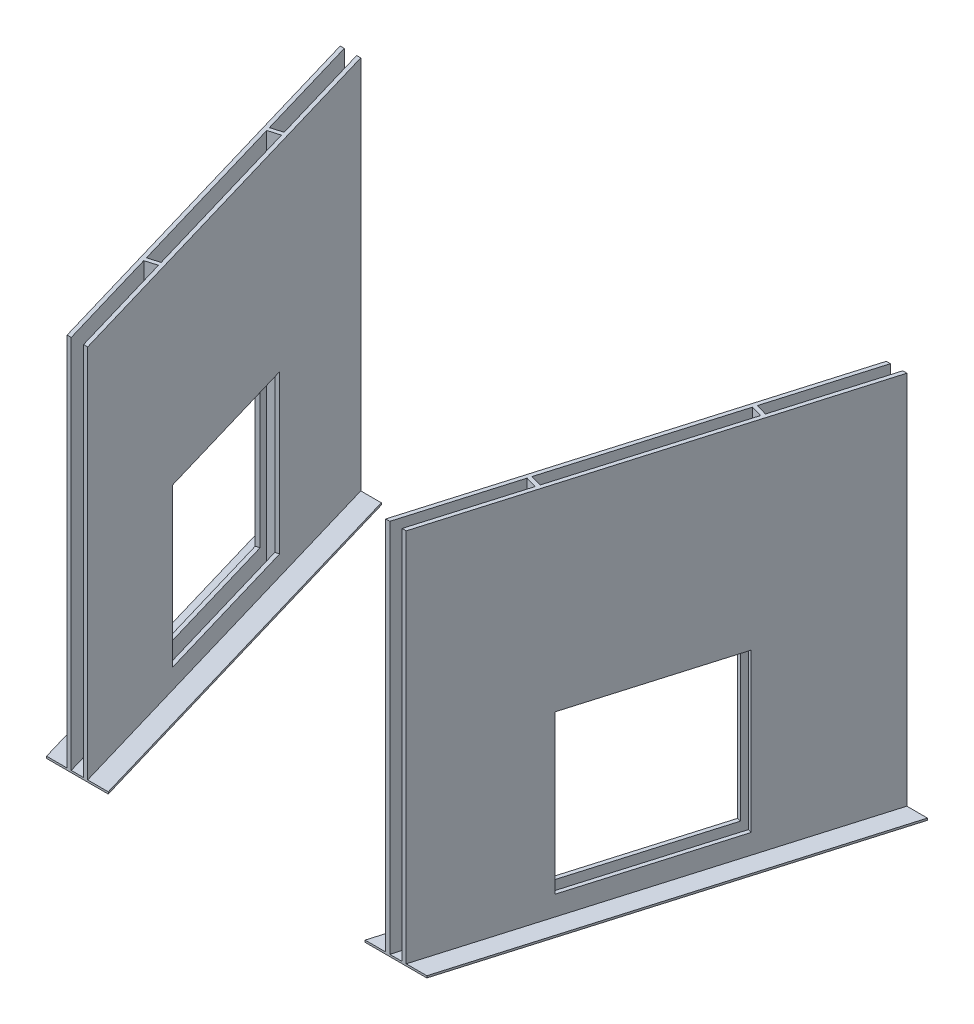
from build123d import *

# Parameters (mm, degrees)
BOSS_EXTRUDE2_DEPTH      = 245.11
BOSS_EXTRUDE2_2_DEPTH    = 245.11
BOSS_EXTRUDE2_3_DEPTH    = 245.11
BOSS_EXTRUDE2_4_DEPTH    = 245.11
BOSS_EXTRUDE3_DEPTH      = 245.11
SKETCH4_W                = 264.758321603
SKETCH4_H                = 1.27
BOSS_EXTRUDE4_DEPTH      = 12.7
BOSS_EXTRUDE5_DEPTH      = 12.7
BOSS_EXTRUDE5_DEPTH_BACK = 12.7
SKETCH6_W                = 264.758321603
SKETCH6_H                = 1.27
BOSS_EXTRUDE6_DEPTH      = 12.7
BOSS_EXTRUDE6_DEPTH_BACK = 12.7
SKETCH7_W                = 264.758321603
SKETCH7_H                = 1.27
SKETCH8_W                = 264.758321603
SKETCH8_H                = 1.27
BOSS_EXTRUDE7_DEPTH      = 12.7
SKETCH13_W               = 101.6
SKETCH13_H               = 101.6
CUT_EXTRUDE1_DEPTH       = 12.7
SKETCH14_W               = 26.475832161
SKETCH14_H               = 3.583512315
CUT_EXTRUDE2_DEPTH       = 340.488918503
SKETCH15_W               = 26.475832161
SKETCH15_H               = 3.583512315
CUT_EXTRUDE3_DEPTH       = 340.488918503
BOSS_EXTRUDE8_DEPTH      = 1.27
BOSS_EXTRUDE9_DEPTH      = 1.27
SKETCH18_W               = 101.6
SKETCH18_H               = 101.6
CUT_EXTRUDE4_DEPTH       = 434.441384542
CUT_EXTRUDE5_DEPTH       = 339.736410143
CUT_EXTRUDE5_DEPTH_BACK  = 339.736410143
SKETCH19_W               = 254
SKETCH19_H               = 2.54
CUT_EXTRUDE6_DEPTH       = 339.736410143
CUT_EXTRUDE6_DEPTH_BACK  = 339.736410143
SKETCH20_W               = 392.603838272
SKETCH20_H               = 2.54


with BuildPart() as part:
    # Sketch2 → Boss-Extrude2 (new body)
    with BuildSketch(Plane(origin=(0, 0, 0), x_dir=(1, 0, 0), z_dir=(0, 1, 0))):
        Polygon((-159.589794279, 56.189473094), (-152.279429157, 58.339580483), (-151.562726694, 55.902792109), (-158.873091816, 53.75268472), align=None)
    extrude(amount=-BOSS_EXTRUDE2_DEPTH)



with BuildPart() as body_2:
    # Sketch2 → Boss-Extrude2 2 (new body)
    with BuildSketch(Plane(origin=(0, 0, 0), x_dir=(1, 0, 0), z_dir=(0, 1, 0))):
        Polygon((-125.904778521, -58.339580483), (-118.594413399, -56.189473094), (-119.311115862, -53.75268472), (-126.621480984, -55.902792109), align=None)
    extrude(amount=-BOSS_EXTRUDE2_2_DEPTH)


with BuildPart() as body_3:
    # Sketch2 → Boss-Extrude2 3 (new body)
    with BuildSketch(Plane(origin=(0, 0, 0), x_dir=(1, 0, 0), z_dir=(0, 1, 0))):
        Polygon((119.311115862, -53.75268472), (118.594413399, -56.189473094), (125.904778521, -58.339580483), (126.621480984, -55.902792109), align=None)
    extrude(amount=-BOSS_EXTRUDE2_3_DEPTH)


with BuildPart() as body_4:
    # Sketch2 → Boss-Extrude2 4 (new body)
    with BuildSketch(Plane(origin=(0, 0, 0), x_dir=(1, 0, 0), z_dir=(0, 1, 0))):
        Polygon((158.873091816, 53.75268472), (159.589794279, 56.189473094), (152.279429157, 58.339580483), (151.562726694, 55.902792109), align=None)
    extrude(amount=-BOSS_EXTRUDE2_4_DEPTH)


with BuildPart() as part_1:
    add(part.part)

    add(body_2.part)  # Boss-Extrude3 merges body 2

    add(body_3.part)  # Boss-Extrude3 merges body 3

    add(body_4.part)  # Boss-Extrude3 merges body 4
    # Sketch3 → Boss-Extrude3 (add)
    with BuildSketch(Plane(origin=(0, 0, 0), x_dir=(1, 0, 0), z_dir=(0, 1, 0))):
        Polygon((-152.279429157, 58.339580483), (-172.473670191, 127), (-169.826086975, 127), (-95.120204622, -127), (-97.767787838, -127), (-118.594413399, -56.189473094), align=None)
        Polygon((-180.416419839, 127), (-183.064003056, 127), (-108.358120703, -127), (-105.710537487, -127), (-125.904778521, -58.339580483), (-159.589794279, 56.189473094), align=None)
        Polygon((159.589794279, 56.189473094), (180.416419839, 127), (183.064003056, 127), (108.358120703, -127), (105.710537487, -127), (125.904778521, -58.339580483), align=None)
        Polygon((152.279429157, 58.339580483), (118.594413399, -56.189473094), (97.767787838, -127), (95.120204622, -127), (169.826086975, 127), (172.473670191, 127), align=None)
    extrude(amount=-BOSS_EXTRUDE3_DEPTH)

    # Sketch4 → Boss-Extrude4 (add)
    with BuildSketch(Plane(origin=(-134.109862685, 0, 39.44407726), x_dir=(0.28216632399155117, 0, 0.9593655015712703), z_dir=(-0.9593655015712702, 0, 0.2821663239915511))):
        with Locations((-41.114754696, -244.475)):
            Rectangle(SKETCH4_W, SKETCH4_H)
    extrude(amount=BOSS_EXTRUDE4_DEPTH)

    # Sketch6 → Boss-Extrude5 (add, two sides: drawn at the far end of the back side and taken through both)
    with BuildSketch(Plane(origin=(-121.925920815, 0, 35.860564946), x_dir=(-0.28216632399155095, 0, -0.9593655015712704), z_dir=(0.9593655015712704, 0, -0.28216632399155095)).offset(-BOSS_EXTRUDE5_DEPTH_BACK)):
        with Locations((37.379460577, -244.475)):
            Rectangle(SKETCH6_W, SKETCH6_H)
    extrude(amount=BOSS_EXTRUDE5_DEPTH + BOSS_EXTRUDE5_DEPTH_BACK)

    # Sketch7 → Boss-Extrude6 (add, two sides: drawn at the far end of the back side and taken through both)
    with BuildSketch(Plane(origin=(121.925920815, 0, 35.860564946), x_dir=(-0.28216632399155095, 0, 0.9593655015712704), z_dir=(-0.9593655015712704, 0, -0.28216632399155095)).offset(-BOSS_EXTRUDE6_DEPTH_BACK)):
        with Locations((-37.379460577, -244.475)):
            Rectangle(SKETCH7_W, SKETCH7_H)
    extrude(amount=BOSS_EXTRUDE6_DEPTH + BOSS_EXTRUDE6_DEPTH_BACK)

    # Sketch8 → Boss-Extrude7 (add)
    with BuildSketch(Plane(origin=(134.109862685, 0, 39.44407726), x_dir=(0.28216632399155117, 0, -0.9593655015712703), z_dir=(0.9593655015712702, 0, 0.2821663239915511))):
        with Locations((41.114754696, -244.475)):
            Rectangle(SKETCH8_W, SKETCH8_H)
    extrude(amount=BOSS_EXTRUDE7_DEPTH)

    # Sketch13 → Cut-Extrude1 (cut)
    with BuildSketch(Plane(origin=(-134.109862685, 0, 39.44407726), x_dir=(0.28216632399155117, 0, 0.9593655015712703), z_dir=(-0.9593655015712702, 0, 0.2821663239915511))):
        with Locations((-39.247107636, -180.34)):
            Rectangle(SKETCH13_W, SKETCH13_H)
    extrude(amount=-CUT_EXTRUDE1_DEPTH, mode=Mode.SUBTRACT)

    # Sketch14 → Cut-Extrude2 (cut, through all)
    with BuildSketch(Plane(origin=(0, 0, 0), x_dir=(1, 0, 0), z_dir=(0, 1, 0))):
        with Locations((-169.826086976, 128.791756158)):
            Rectangle(SKETCH14_W, SKETCH14_H)
        with Locations((169.826086976, 128.791756158)):
            Rectangle(SKETCH14_W, SKETCH14_H)
    extrude(amount=-CUT_EXTRUDE2_DEPTH, mode=Mode.SUBTRACT)

    # Sketch15 → Cut-Extrude3 (cut, through all)
    with BuildSketch(Plane(origin=(0, 0, 0), x_dir=(1, 0, 0), z_dir=(0, 1, 0))):
        with Locations((-108.358120703, -128.791756158)):
            Rectangle(SKETCH15_W, SKETCH15_H)
        with Locations((108.358120703, -128.791756158)):
            Rectangle(SKETCH15_W, SKETCH15_H)
    extrude(amount=-CUT_EXTRUDE3_DEPTH, mode=Mode.SUBTRACT)

    # Sketch16 → Boss-Extrude8 (add)
    with BuildSketch(Plane.XZ.offset(245.11)):
        Polygon((-82.936262752, 123.416487685), (-95.120204622, 123.416487685), (-95.120204622, 127), (-81.882288542, 127), align=None)
        Polygon((82.936262752, 123.416487685), (81.882288542, 127), (95.120204622, 127), (95.120204622, 123.416487685), align=None)
    extrude(amount=-BOSS_EXTRUDE8_DEPTH)

    # Sketch17 → Boss-Extrude9 (add)
    with BuildSketch(Plane.XZ.offset(245.11)):
        Polygon((-195.247944925, -123.416487685), (-196.301919136, -127), (-156.588170895, -127), (-156.588170895, -123.416487685), align=None)
        Polygon((156.588170895, -123.416487685), (195.247944925, -123.416487685), (196.301919136, -127), (156.588170895, -127), align=None)
    extrude(amount=-BOSS_EXTRUDE9_DEPTH)

    # Sketch18 → Cut-Extrude4 (cut, through all)
    with BuildSketch(Plane(origin=(121.925920815, 0, 35.860564946), x_dir=(-0.28216632399155095, 0, 0.9593655015712704), z_dir=(-0.9593655015712704, 0, -0.28216632399155095))):
        with Locations((-39.247107636, -180.34)):
            Rectangle(SKETCH18_W, SKETCH18_H)
    extrude(amount=-CUT_EXTRUDE4_DEPTH, mode=Mode.SUBTRACT)

    # Sketch19 → Cut-Extrude5 (cut, two sides: drawn at the far end of the back side and taken through both)
    with BuildSketch(Plane(origin=(0, 0, 0), x_dir=(0, 0, -1), z_dir=(1, 0, 0)).offset(-CUT_EXTRUDE5_DEPTH_BACK)):
        with Locations((0, -1.27)):
            Rectangle(SKETCH19_W, SKETCH19_H)
    extrude(amount=CUT_EXTRUDE5_DEPTH + CUT_EXTRUDE5_DEPTH_BACK, mode=Mode.SUBTRACT)

    # Sketch20 → Cut-Extrude6 (cut, two sides: drawn at the far end of the back side and taken through both)
    with BuildSketch(Plane(origin=(0, 0, 0), x_dir=(1, 0, 0), z_dir=(0, 1, 0)).offset(-CUT_EXTRUDE6_DEPTH_BACK)):
        with Locations((0, 125.73)):
            Rectangle(SKETCH20_W, SKETCH20_H)
        with Locations((0, -125.73)):
            Rectangle(SKETCH20_W, SKETCH20_H)
    extrude(amount=CUT_EXTRUDE6_DEPTH + CUT_EXTRUDE6_DEPTH_BACK, mode=Mode.SUBTRACT)


solid = part_1.part
